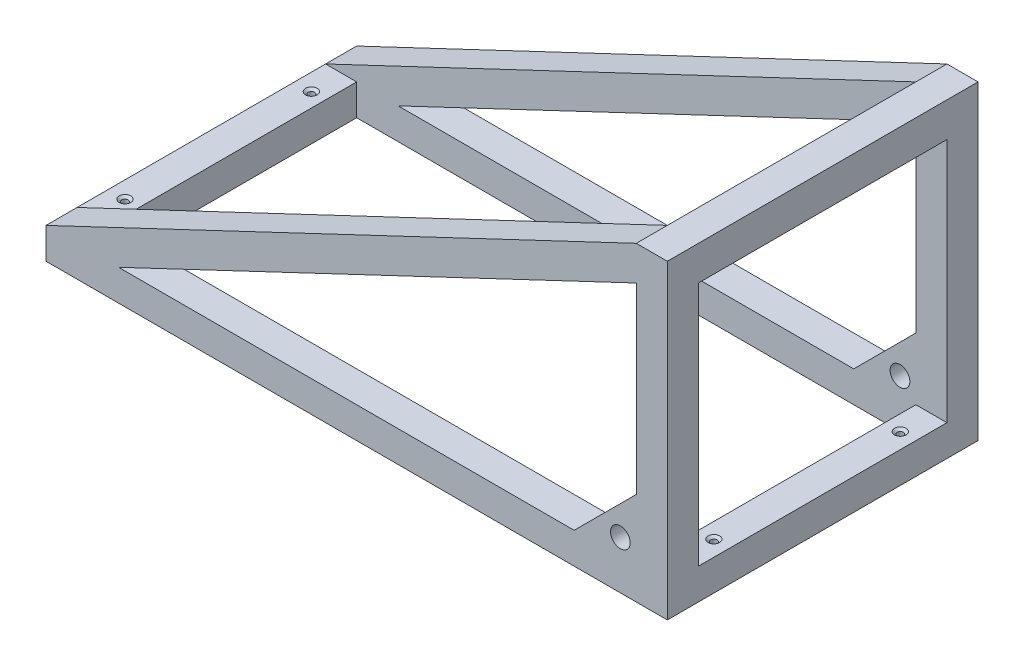
from build123d import *

# Parameters (mm, degrees)
SKETCH1_W                                         = 180
SKETCH1_H                                         = 80
BOSS_EXTRUDE1_DEPTH                               = 10
SKETCH2_W                                         = 10
SKETCH2_H                                         = 10
BOSS_EXTRUDE2_DEPTH                               = 90
EXTRUDE_THIN1_DEPTH                               = 10
SKETCH4_W                                         = 10
SKETCH4_H                                         = 11.065155811
BOSS_EXTRUDE3_DEPTH                               = 80
RIB3_REACH                                        = 175.205
SKETCH5_WALL_W                                    = 376.694432762
SKETCH5_WALL_H                                    = 10
CUT_EXTRUDE1_START                                = -100
SKETCH6_R                                         = 3.175
CUT_EXTRUDE1_DEPTH                                = 100
CSK_FOR_1_FLAT_HEAD_MACHINE_SCREW_100_D           = 2.0574
CSK_FOR_1_FLAT_HEAD_MACHINE_SCREW_100_DEPTH       = 50
CSK_FOR_1_FLAT_HEAD_MACHINE_SCREW_100_CSINK_D     = 3.7084
CSK_FOR_1_FLAT_HEAD_MACHINE_SCREW_100_CSINK_ANGLE = 100
CSK_FOR_1_FLAT_HEAD_MACHINE_SCREW_100_TIP         = 0.618105319


with BuildPart() as part:
    # Sketch1 → Boss-Extrude1 (new body)
    with BuildSketch(Plane(origin=(0, 0, 0), x_dir=(1, 0, 0), z_dir=(0, 1, 0))):
        Polygon((100, 27.343827347), (100, 50), (-100, 50), (-100, 27.343827347), (-100, -27.343827347), (-100, -50), (100, -50), (100, -27.343827347), align=None)
        Rectangle(SKETCH1_W, SKETCH1_H, mode=Mode.SUBTRACT)
    extrude(amount=BOSS_EXTRUDE1_DEPTH)

    # Sketch2 → Boss-Extrude2 (add)
    with BuildSketch(Plane(origin=(0, 10, 0), x_dir=(1, 0, 0), z_dir=(0, 1, 0))):
        with Locations((95, -45)):
            Rectangle(SKETCH2_W, SKETCH2_H)
        with Locations((95, 45)):
            Rectangle(SKETCH2_W, SKETCH2_H)
    extrude(amount=BOSS_EXTRUDE2_DEPTH)

    # Sketch3 → Extrude-Thin1 (add)
    with BuildSketch(Plane.XY.offset(50)):
        Polygon((-100, 10), (90, 100), (94.280863447, 90.962621611), (-95.719136553, 0.962621611), align=None)
    extrude_thin1 = extrude(amount=-EXTRUDE_THIN1_DEPTH)

    # Mirror1: Extrude-Thin1 across plane
    add(extrude_thin1.mirror(Plane.XY))

    # Sketch4 → Boss-Extrude3 (add)
    with BuildSketch(Plane.XY.offset(-40)):
        with Locations((95, 94.467422094)):
            Rectangle(SKETCH4_W, SKETCH4_H)
    extrude(amount=BOSS_EXTRUDE3_DEPTH)

    # Sketch5 wall → Rib3 (add, up to next)
    with BuildSketch(Plane(origin=(80, 20, 50), x_dir=(-0.707106781187, -0.707106781187, 0), z_dir=(0.707106781187, -0.707106781187, 0)), mode=Mode.PRIVATE) as rib3_sk1:
        with Locations((0, 5)):
            Rectangle(SKETCH5_WALL_W, SKETCH5_WALL_H)
    rib3_tool1 = extrude(rib3_sk1.sketch, amount=RIB3_REACH, mode=Mode.PRIVATE) - part.part
    rib3 = rib3_tool1.solids().sort_by_distance((80, 20, 50))[0]
    add(rib3)

    # Mirror2: Rib3 across plane
    add(rib3.mirror(Plane.XY))

    # Sketch6 → Cut-Extrude1 (cut)
    with BuildSketch(Plane.XY.offset(50).offset(CUT_EXTRUDE1_START)):
        with Locations((84.882990755, 15.483266945)):
            Circle(SKETCH6_R)
    extrude(amount=CUT_EXTRUDE1_DEPTH, mode=Mode.SUBTRACT)

    # CSK for #1 Flat Head Machine Screw (100)1
    with Locations(Plane(origin=(0, 10, 0), x_dir=(1, 0, 0), z_dir=(0, 1, 0))):
        with Locations((-94.584598499, -30), (-94.584598499, 30), (94.978129644, 30), (94.978129644, -30)):
            CounterSinkHole(CSK_FOR_1_FLAT_HEAD_MACHINE_SCREW_100_D / 2, CSK_FOR_1_FLAT_HEAD_MACHINE_SCREW_100_CSINK_D / 2, depth=CSK_FOR_1_FLAT_HEAD_MACHINE_SCREW_100_DEPTH, counter_sink_angle=CSK_FOR_1_FLAT_HEAD_MACHINE_SCREW_100_CSINK_ANGLE)
            with Locations((0, 0, -(CSK_FOR_1_FLAT_HEAD_MACHINE_SCREW_100_DEPTH + CSK_FOR_1_FLAT_HEAD_MACHINE_SCREW_100_TIP / 2))):  # 118° drill point
                Cone(0, CSK_FOR_1_FLAT_HEAD_MACHINE_SCREW_100_D / 2, CSK_FOR_1_FLAT_HEAD_MACHINE_SCREW_100_TIP, mode=Mode.SUBTRACT)


solid = part.part
